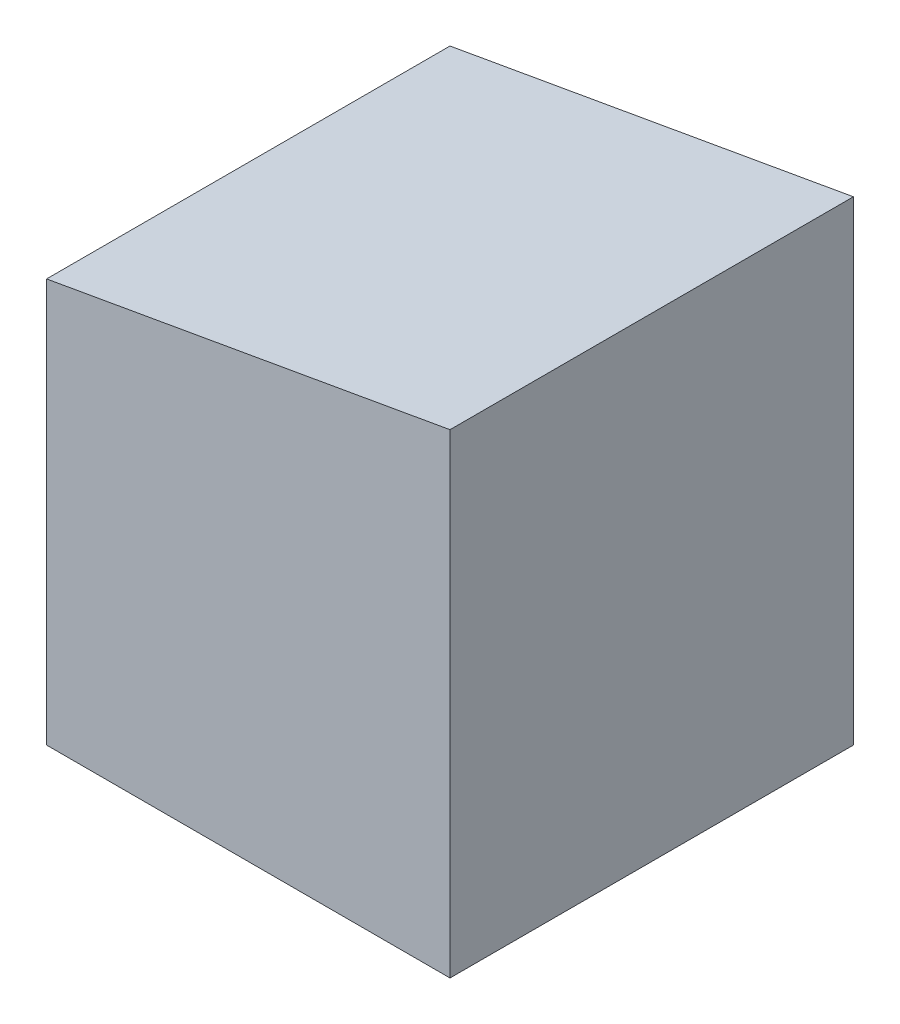
from build123d import *

# Parameters (mm, degrees)
SKETCH1_W           = 88.9
SKETCH1_H           = 88.9
BOSS_EXTRUDE1_DEPTH = 104.648
CUT_EXTRUDE1_DEPTH  = 135


with BuildPart() as part:
    # Sketch1 → Boss-Extrude1 (new body)
    with BuildSketch(Plane(origin=(0, 0, 0), x_dir=(1, 0, 0), z_dir=(0, 1, 0))):
        Rectangle(SKETCH1_W, SKETCH1_H)
    extrude(amount=BOSS_EXTRUDE1_DEPTH)

    # Sketch2 → Cut-Extrude1 (cut)
    with BuildSketch(Plane.XY.offset(44.45)):
        Polygon((44.45, 104.648), (-44.45, 88.972531415), (-44.45, 104.648), align=None)
    extrude(amount=-CUT_EXTRUDE1_DEPTH, mode=Mode.SUBTRACT)


solid = part.part
